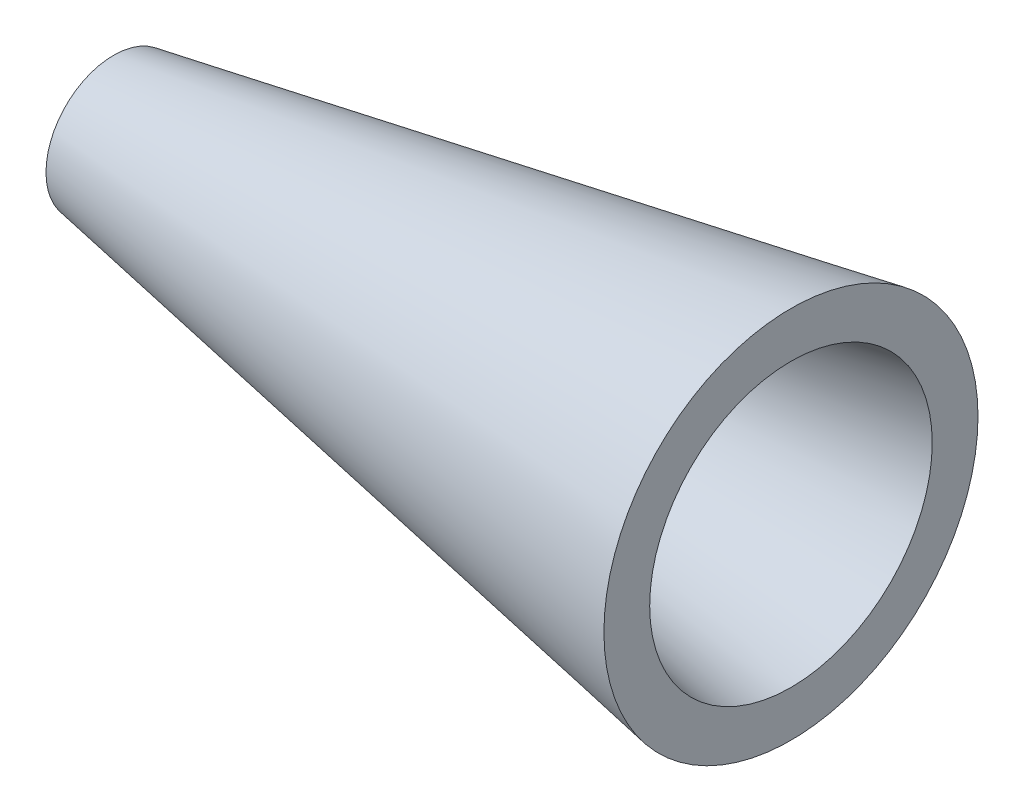
from build123d import *

# Parameters (mm, degrees)
SHELL1_T = -2


with BuildPart() as part:
    # Sketch1 → Revolve1 (revolve)
    with BuildSketch(Plane.XY, mode=Mode.PRIVATE) as revolve1_sk:
        Polygon((-19.999669342, 0), (-19.999669342, 3), (10.058124302, 8.3), (10.058124302, 0), align=None)
    revolve(revolve1_sk.sketch.rotate(Axis((-20.932600226, 0, 0), (1, 0, 0)), 90), axis=Axis((-20.932600226, 0, 0), (1, 0, 0)))

    # Shell1
    shell1_openings = [part.faces().sort_by_distance(p)[0] for p in [
        (10.058124302, 0, 0),
    ]]
    offset(amount=SHELL1_T, openings=shell1_openings, kind=Kind.INTERSECTION)


solid = part.part
